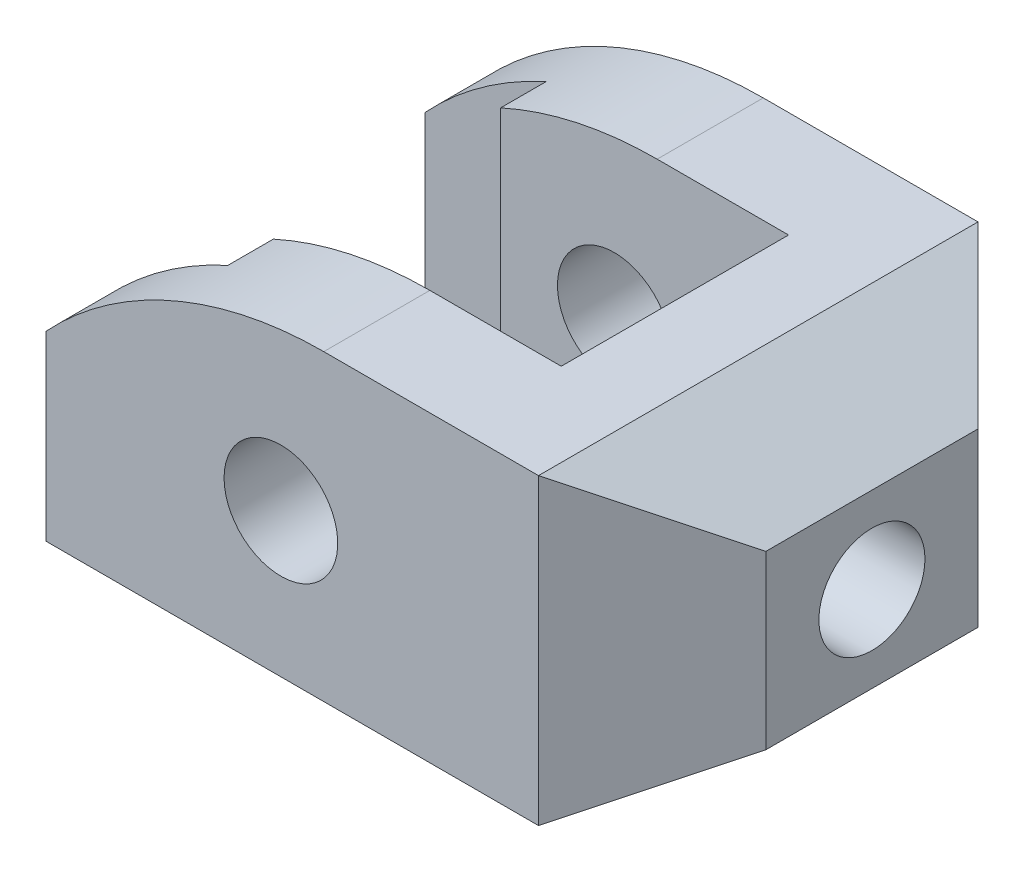
from build123d import *

# Parameters (mm, degrees)
SKETCH1_R           = 7.5
BOSS_EXTRUDE1_DEPTH = 58
CUT_EXTRUDE1_DEPTH  = 107.60206377
CUT_EXTRUDE6_DEPTH  = 107.60206377
SKETCH6_R           = 7
CUT_EXTRUDE7_DEPTH  = 107.60206377


with BuildPart() as part:
    # Sketch1 → Boss-Extrude1 (new body)
    with BuildSketch(Plane.XY):
        with BuildLine():
            Line((0, 0), (0, 24))
            ThreePointArc((0, 24), (16.66060556, 35.82575695), (36.66060556, 40))
            Line((36.66060556, 40), (65, 40))
            Line((65, 40), (80, 31.339745962))
            Line((80, 31.339745962), (80, 8.660254038))
            Line((80, 8.660254038), (65, 0))
            Line((65, 0), (0, 0))
        make_face()
        with Locations(Location((31, 19, 0), (0, 0, 180))):
            Circle(SKETCH1_R, mode=Mode.SUBTRACT)
    extrude(amount=BOSS_EXTRUDE1_DEPTH)

    # Sketch2 → Cut-Extrude1 (cut, through all)
    with BuildSketch(Plane(origin=(0, 40, 0), x_dir=(1, 0, 0), z_dir=(0, 1, 0))):
        Polygon((0, -8), (16, -8), (16, -14), (54, -14), (54, -44), (16, -44), (16, -50), (0, -50), align=None)
    extrude(amount=-CUT_EXTRUDE1_DEPTH, mode=Mode.SUBTRACT)

    # Sketch5 → Cut-Extrude6 (cut, through all)
    with BuildSketch(Plane(origin=(0, 40, 0), x_dir=(1, 0, 0), z_dir=(0, 1, 0))):
        Polygon((65, 0), (80, -15), (80, 0), align=None)
        Polygon((65, -58), (80, -58), (80, -43), align=None)
    extrude(amount=-CUT_EXTRUDE6_DEPTH, mode=Mode.SUBTRACT)

    # Sketch6 → Cut-Extrude7 (cut, through all)
    with BuildSketch(Plane(origin=(80, 0, 0), x_dir=(0, 0, -1), z_dir=(1, 0, 0))):
        with Locations((-29, 20)):
            Circle(SKETCH6_R)
    extrude(amount=-CUT_EXTRUDE7_DEPTH, mode=Mode.SUBTRACT)


solid = part.part
